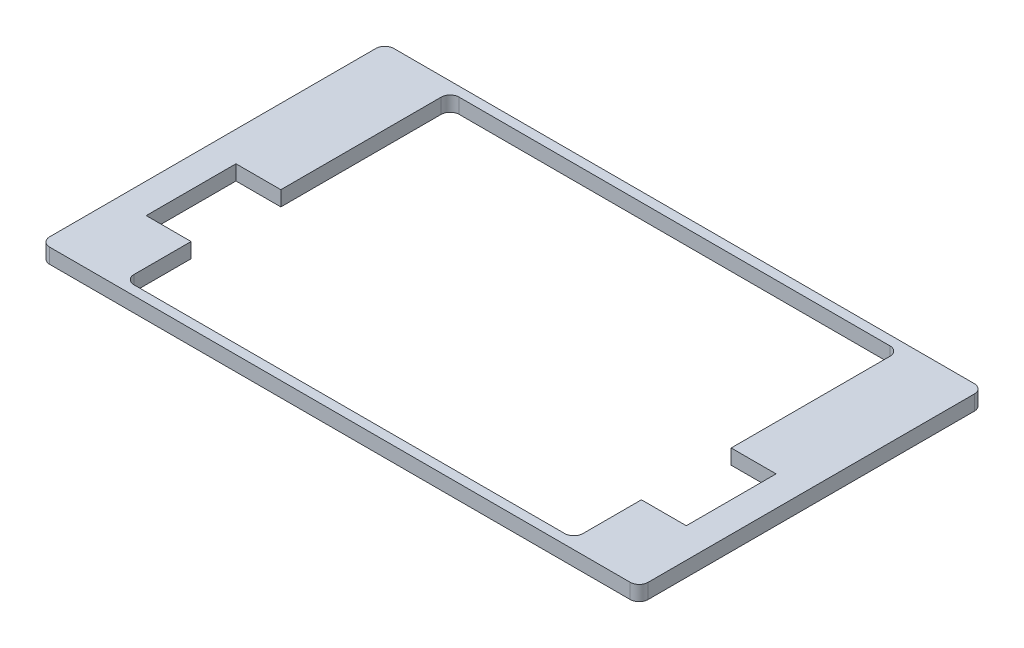
from build123d import *

# Parameters (mm, degrees)
BOSS_EXTRUDE1_DEPTH = 6.35
SKETCH3_W           = 19.05
SKETCH3_H           = 38.1
CUT_EXTRUDE1_DEPTH  = 294.064711284


with BuildPart() as part:
    # Sketch1 → Boss-Extrude1 (new body)
    with BuildSketch(Plane(origin=(0, 0, 0), x_dir=(1, 0, 0), z_dir=(0, 1, 0))):
        with BuildLine():
            Line((3.81, 0), (250.19, 0))
            ThreePointArc((250.19, 0), (252.884076836, 1.115923164), (254, 3.81))
            Line((254, 3.81), (254, 142.24))
            ThreePointArc((254, 142.24), (252.884076836, 144.934076836), (250.19, 146.05))
            Line((250.19, 146.05), (3.81, 146.05))
            ThreePointArc((3.81, 146.05), (1.115923164, 144.934076836), (0, 142.24))
            Line((0, 142.24), (0, 3.81))
            ThreePointArc((0, 3.81), (1.115923164, 1.115923164), (3.81, 0))
        make_face()
        with BuildLine():
            Line((35.56, 142.025), (218.44, 142.025))
            ThreePointArc((218.44, 142.025), (221.134076836, 140.909076836), (222.25, 138.215))
            Line((222.25, 138.215), (222.25, 7.835))
            ThreePointArc((222.25, 7.835), (221.134076836, 5.140923164), (218.44, 4.025))
            Line((218.44, 4.025), (35.56, 4.025))
            ThreePointArc((35.56, 4.025), (32.865923164, 5.140923164), (31.75, 7.835))
            Line((31.75, 7.835), (31.75, 138.215))
            ThreePointArc((31.75, 138.215), (32.865923164, 140.909076836), (35.56, 142.025))
        make_face(mode=Mode.SUBTRACT)
    extrude(amount=BOSS_EXTRUDE1_DEPTH)

    # Sketch3 → Cut-Extrude1 (cut, through all)
    with BuildSketch(Plane.XZ):
        with Locations((231.775, -51.7525)):
            Rectangle(SKETCH3_W, SKETCH3_H)
        with Locations((22.225, -51.1175)):
            Rectangle(SKETCH3_W, SKETCH3_H)
    extrude(amount=-CUT_EXTRUDE1_DEPTH, mode=Mode.SUBTRACT)


solid = part.part
